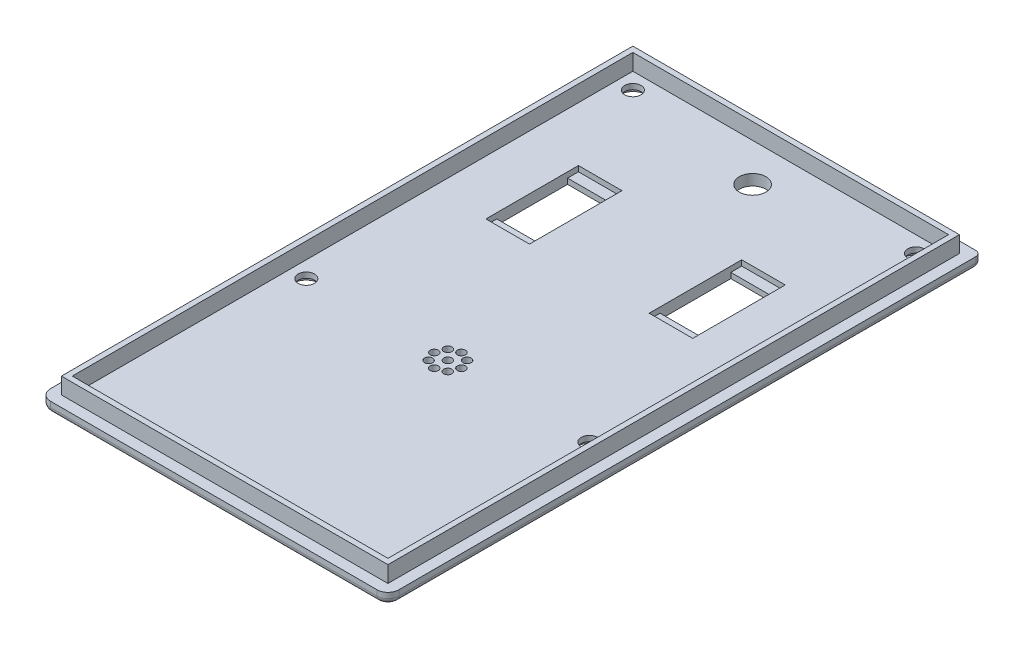
from build123d import *

# Parameters (mm, degrees)
SKETCH1_W           = 64
SKETCH1_H           = 109
BOSS_EXTRUDE1_DEPTH = 2
SKETCH2_W           = 60
SKETCH2_H           = 105
BOSS_EXTRUDE2_DEPTH = 3
SKETCH3_W           = 58
SKETCH3_H           = 103
CUT_EXTRUDE1_DEPTH  = 3
SKETCH4_R           = 1.5
CUT_EXTRUDE2_DEPTH  = 2
SKETCH6_R           = 2.5
CUT_EXTRUDE3_DEPTH  = 1
SKETCH7_R           = 2.45
CUT_EXTRUDE4_DEPTH  = 2
SKETCH8_W           = 8
SKETCH8_H           = 13
CUT_EXTRUDE5_DEPTH  = 2
SKETCH9_W           = 8
SKETCH9_H           = 13
CUT_EXTRUDE6_DEPTH  = 2
FILLET2_R           = 1
FILLET3_R           = 1
FILLET4_R           = 2
FILLET5_R           = 2
FILLET6_R           = 1
SKETCH10_W          = 8
SKETCH10_H          = 17
CUT_EXTRUDE7_DEPTH  = 1
SKETCH11_R          = 0.75
CUT_EXTRUDE8_DEPTH  = 2


with BuildPart() as part:
    # Sketch1 → Boss-Extrude1 (new body)
    with BuildSketch(Plane(origin=(0, 0, 0), x_dir=(1, 0, 0), z_dir=(0, 1, 0))):
        Rectangle(SKETCH1_W, SKETCH1_H)
    extrude(amount=BOSS_EXTRUDE1_DEPTH)

    # Sketch2 → Boss-Extrude2 (add)
    with BuildSketch(Plane(origin=(0, 2, 0), x_dir=(1, 0, 0), z_dir=(0, 1, 0))):
        Rectangle(SKETCH2_W, SKETCH2_H)
    extrude(amount=BOSS_EXTRUDE2_DEPTH)

    # Sketch3 → Cut-Extrude1 (cut)
    with BuildSketch(Plane(origin=(0, 5, 0), x_dir=(1, 0, 0), z_dir=(0, 1, 0))):
        Rectangle(SKETCH3_W, SKETCH3_H)
    extrude(amount=-CUT_EXTRUDE1_DEPTH, mode=Mode.SUBTRACT)

    # Sketch4 → Cut-Extrude2 (cut)
    with BuildSketch(Plane(origin=(0, 2, 0), x_dir=(1, 0, 0), z_dir=(0, 1, 0))):
        with Locations(Location((-26, 48.5, 0), (0, 0, 270))):
            Circle(SKETCH4_R)
        with Locations(Location((-26, -11.5, 0), (0, 0, 270))):
            Circle(SKETCH4_R)
        with Locations(Location((26, -11.5, 0), (0, 0, 90))):
            Circle(SKETCH4_R)
        with Locations(Location((26, 48.5, 0), (0, 0, 90))):
            Circle(SKETCH4_R)
    extrude(amount=-CUT_EXTRUDE2_DEPTH, mode=Mode.SUBTRACT)

    # Sketch6 → Cut-Extrude3 (cut)
    with BuildSketch(Plane.XZ):
        with Locations(Location((26, -48.5, 0), (0, 0, 270))):
            Circle(SKETCH6_R)
        with Locations(Location((-26, -48.5, 0), (0, 0, 270))):
            Circle(SKETCH6_R)
        with Locations(Location((26, 11.5, 0), (0, 0, 270))):
            Circle(SKETCH6_R)
        with Locations(Location((-26, 11.5, 0), (0, 0, 270))):
            Circle(SKETCH6_R)
    extrude(amount=-CUT_EXTRUDE3_DEPTH, mode=Mode.SUBTRACT)

    # Sketch7 → Cut-Extrude4 (cut)
    with BuildSketch(Plane(origin=(0, 2, 0), x_dir=(1, 0, 0), z_dir=(0, 1, 0))):
        with Locations(Location((0, 44.5, 0), (0, 0, 270))):
            Circle(SKETCH7_R)
    extrude(amount=-CUT_EXTRUDE4_DEPTH, mode=Mode.SUBTRACT)

    # Sketch8 → Cut-Extrude5 (cut)
    with BuildSketch(Plane(origin=(0, 2, 0), x_dir=(1, 0, 0), z_dir=(0, 1, 0))):
        with Locations((-15, 23)):
            Rectangle(SKETCH8_W, SKETCH8_H)
    extrude(amount=-CUT_EXTRUDE5_DEPTH, mode=Mode.SUBTRACT)

    # Sketch9 → Cut-Extrude6 (cut)
    with BuildSketch(Plane(origin=(0, 2, 0), x_dir=(1, 0, 0), z_dir=(0, 1, 0))):
        with Locations((15, 23)):
            Rectangle(SKETCH9_W, SKETCH9_H)
    extrude(amount=-CUT_EXTRUDE6_DEPTH, mode=Mode.SUBTRACT)

    # Fillet2
    fillet2_edges = [part.edges().sort_by_distance(p)[0] for p in [
        (32, 1, -54.5),
    ]]
    fillet(fillet2_edges, radius=FILLET2_R)

    # Fillet3
    fillet3_edges = [part.edges().sort_by_distance(p)[0] for p in [
        (-32, 1, -54.5),
    ]]
    fillet(fillet3_edges, radius=FILLET3_R)

    # Fillet4
    fillet4_edges = [part.edges().sort_by_distance(p)[0] for p in [
        (-32, 1, 54.5),
    ]]
    fillet(fillet4_edges, radius=FILLET4_R)

    # Fillet5
    fillet5_edges = [part.edges().sort_by_distance(p)[0] for p in [
        (32, 1, 54.5),
    ]]
    fillet(fillet5_edges, radius=FILLET5_R)

    # Fillet6
    fillet6_edges = [part.edges().sort_by_distance(p)[0] for p in [
        (0, 0, -54.5),
        (31.707106781, 0, -54.207106781),
        (-32, 0, -0.5),
        (-31.707106781, 0, -54.207106781),
        (0, 0, 54.5),
        (-31.414213562, 0, 53.914213562),
        (32, 0, -0.5),
        (31.414213562, 0, 53.914213562),
    ]]
    fillet(fillet6_edges, radius=FILLET6_R)

    # Sketch10 → Cut-Extrude7 (cut)
    with BuildSketch(Plane(origin=(0, 2, 0), x_dir=(1, 0, 0), z_dir=(0, 1, 0))):
        with Locations((-15, 23)):
            Rectangle(SKETCH10_W, SKETCH10_H)
        with Locations((15, 23)):
            Rectangle(SKETCH10_W, SKETCH10_H)
    extrude(amount=-CUT_EXTRUDE7_DEPTH, mode=Mode.SUBTRACT)

    # Sketch11 → Cut-Extrude8 (cut)
    with BuildSketch(Plane(origin=(0, 2, 0), x_dir=(1, 0, 0), z_dir=(0, 1, 0))):
        with Locations(Location((0, -11.5, 0), (0, 0, 270))):
            Circle(SKETCH11_R)
        with Locations(Location((0, -9, 0), (0, 0, 270))):
            Circle(SKETCH11_R)
        with Locations(Location((1.767766953, -9.732233047, 0), (0, 0, 270))):
            Circle(SKETCH11_R)
        with Locations(Location((2.5, -11.5, 0), (0, 0, 270))):
            Circle(SKETCH11_R)
        with Locations(Location((1.767766953, -13.267766953, 0), (0, 0, 270))):
            Circle(SKETCH11_R)
        with Locations(Location((0, -14, 0), (0, 0, 270))):
            Circle(SKETCH11_R)
        with Locations(Location((-1.767766953, -9.732233047, 0), (0, 0, 270))):
            Circle(SKETCH11_R)
        with Locations(Location((-2.5, -11.5, 0), (0, 0, 270))):
            Circle(SKETCH11_R)
        with Locations(Location((-1.767766953, -13.267766953, 0), (0, 0, 270))):
            Circle(SKETCH11_R)
    extrude(amount=-CUT_EXTRUDE8_DEPTH, mode=Mode.SUBTRACT)


solid = part.part
